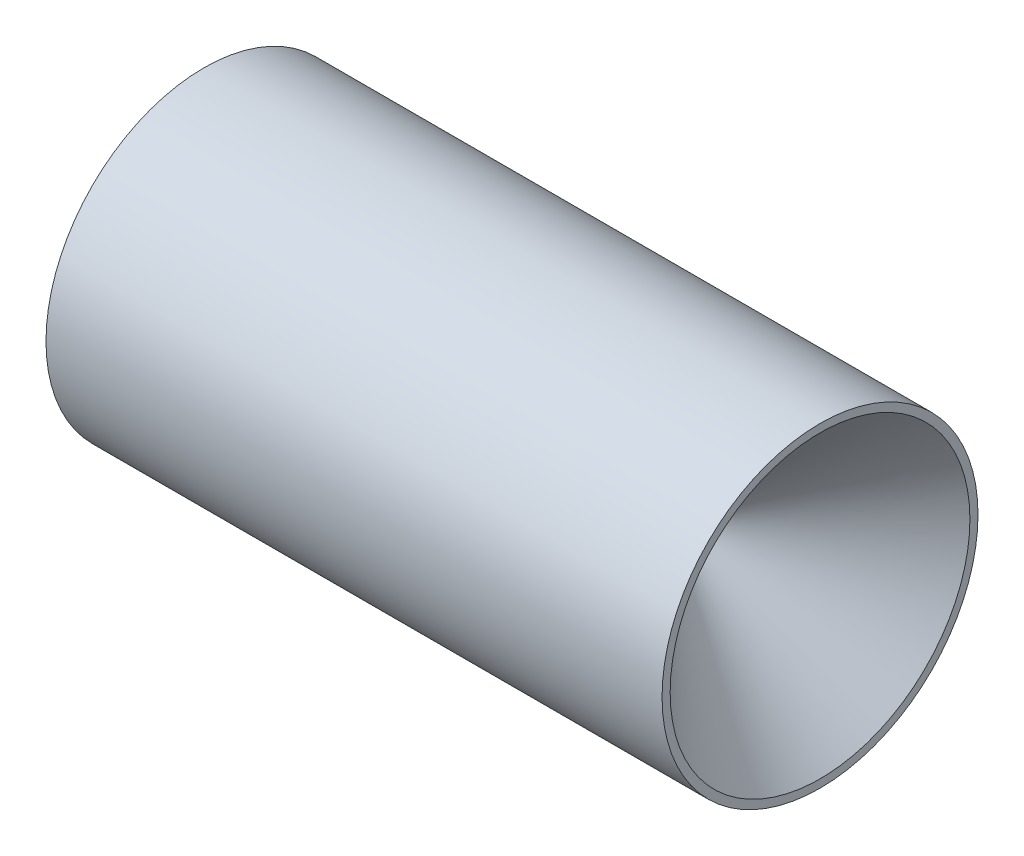
from build123d import *


with BuildPart() as part:
    # Sketch1 → Revolve1 (revolve)
    with BuildSketch(Plane.XY, mode=Mode.PRIVATE) as revolve1_sk:
        Polygon((-78, 20), (0, 20), (0, 18.976056961), (-16.128039924, 2.848017037), (-20.2124492, 2.848017037), (-78, 18.332144607), align=None)
    revolve(revolve1_sk.sketch.rotate(Axis((11.272384543, 0, 0), (-1, 0, 0)), 90), axis=Axis((11.272384543, 0, 0), (-1, 0, 0)))


solid = part.part
